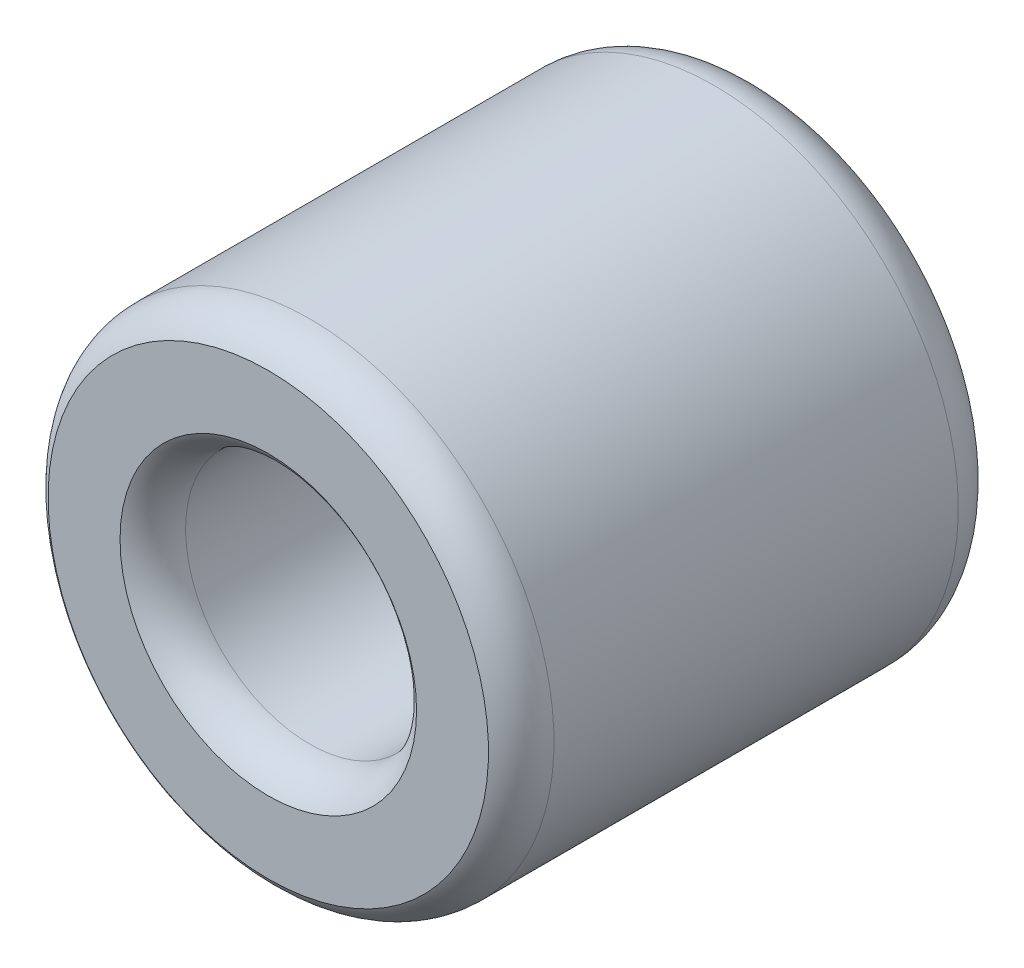
from build123d import *

# Parameters (mm, degrees)
SKETCH3_R           = 3.18135
SKETCH3_R_2         = 1.61925
BOSS_EXTRUDE1_DEPTH = 3.175


with BuildPart() as part:
    # Sketch3 → Boss-Extrude1 (new, symmetric)
    with BuildSketch(Plane.XY):
        Circle(SKETCH3_R)
        Circle(SKETCH3_R_2, mode=Mode.SUBTRACT)
    extrude(amount=BOSS_EXTRUDE1_DEPTH, both=True)

    # Sketch4 → Cut-Revolve1 (revolve, cut)
    with BuildSketch(Plane(origin=(0, 0, 0), x_dir=(0, 0, -1), z_dir=(1, 0, 0))):
        with BuildLine():
            Line((-2.633872687, 3.18135), (-3.175, 3.18135))
            Line((-3.175, 3.18135), (-3.175, 2.86893))
            ThreePointArc((-3.175, 2.86893), (-2.946292687, 3.097637313), (-2.633872687, 3.18135))
        make_face()
        with BuildLine():
            Line((-2.633872687, 1.61925), (-3.175, 1.61925))
            Line((-3.175, 1.61925), (-3.175, 1.93167))
            ThreePointArc((-3.175, 1.93167), (-2.946292687, 1.702962687), (-2.633872687, 1.61925))
        make_face()
        with BuildLine():
            Line((3.175, 1.61925), (3.175, 1.93167))
            ThreePointArc((3.175, 1.93167), (2.946292687, 1.702962687), (2.633872687, 1.61925))
            Line((2.633872687, 1.61925), (3.175, 1.61925))
        make_face()
        with BuildLine():
            Line((3.175, 3.18135), (3.175, 2.86893))
            ThreePointArc((3.175, 2.86893), (2.946292687, 3.097637313), (2.633872687, 3.18135))
            Line((2.633872687, 3.18135), (3.175, 3.18135))
        make_face()
    revolve(axis=Axis((0, 0, -3.175), (0, 0, 1)), mode=Mode.SUBTRACT)


solid = part.part
